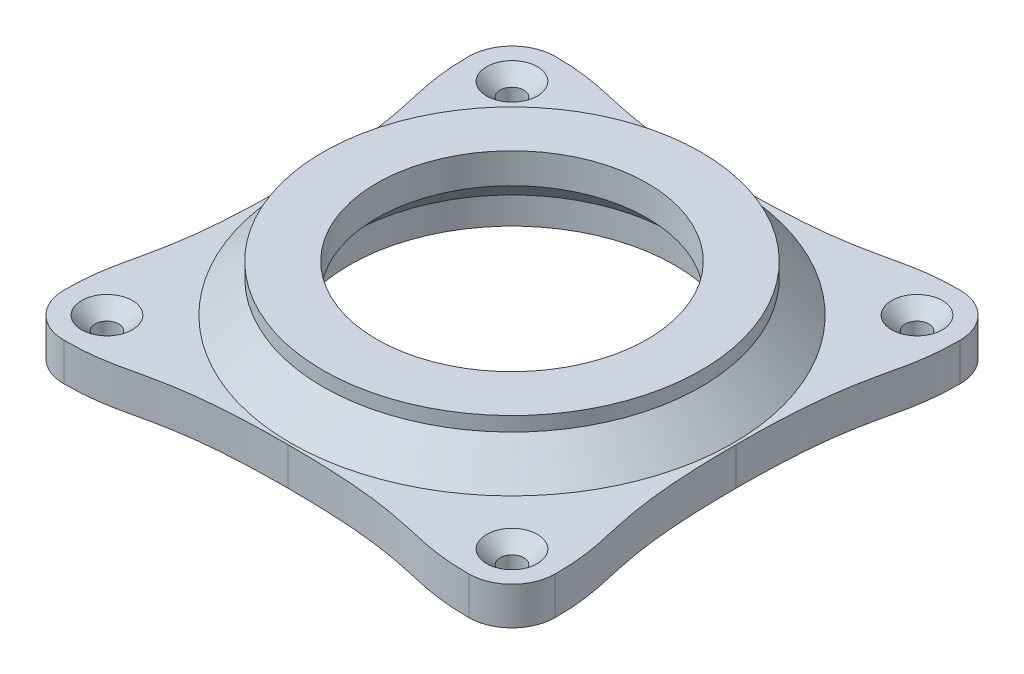
from build123d import *
from build123d.topology import SkipClean

# Parameters (mm, degrees)
SKETCH1_R           = 2.2
SKETCH1_R_2         = 25.05
BOSS_EXTRUDE1_DEPTH = 7
SKETCH6_R           = 35
SKETCH6_R_2         = 25.05
BOSS_EXTRUDE4_DEPTH = 7
CHAMFER1_SIZE       = 2.5
CHAMFER2_SIZE       = 6
BOSS_EXTRUDE8_START = -3.95
SKETCH8_R           = 35
SKETCH8_R_2         = 25.05
BOSS_EXTRUDE8_DEPTH = 5.6


with BuildPart() as part:
    # Sketch1 → Boss-Extrude1 (new body)
    with BuildSketch(Plane(origin=(0, 0, 0), x_dir=(1, 0, 0), z_dir=(0, 1, 0))):
        with BuildLine():
            ThreePointArc((0, 83), (-5.656854249, 80.656854249), (-8, 75))
            add(Edge.make_bspline(
                [(-8, 75), (-8, 62.5), (-4, 62.5), (-4, 37.5)],
                knots=[0, 0, 0, 0, 1, 1, 1, 1], degree=3))
            add(Edge.make_bspline(
                [(-8, 0), (-8, 12.5), (-4, 12.5), (-4, 37.5)],
                knots=[0, 0, 0, 0, 1, 1, 1, 1], degree=3))
            ThreePointArc((-8, 0), (-5.656854249, -5.656854249), (0, -8))
            add(Edge.make_bspline(
                [(0, -8), (12.5, -8), (12.5, -4), (37.5, -4)],
                knots=[0, 0, 0, 0, 1, 1, 1, 1], degree=3))
            add(Edge.make_bspline(
                [(75, -8), (62.5, -8), (62.5, -4), (37.5, -4)],
                knots=[0, 0, 0, 0, 1, 1, 1, 1], degree=3))
            ThreePointArc((75, -8), (80.656854249, -5.656854249), (83, 0))
            add(Edge.make_bspline(
                [(83, 0), (83, 12.5), (79, 12.5), (79, 37.5)],
                knots=[0, 0, 0, 0, 1, 1, 1, 1], degree=3))
            add(Edge.make_bspline(
                [(83, 75), (83, 62.5), (79, 62.5), (79, 37.5)],
                knots=[0, 0, 0, 0, 1, 1, 1, 1], degree=3))
            ThreePointArc((83, 75), (80.656854249, 80.656854249), (75, 83))
            add(Edge.make_bspline(
                [(75, 83), (62.5, 83), (62.5, 79), (37.5, 79)],
                knots=[0, 0, 0, 0, 1, 1, 1, 1], degree=3))
            add(Edge.make_bspline(
                [(0, 83), (12.5, 83), (12.5, 79), (37.5, 79)],
                knots=[0, 0, 0, 0, 1, 1, 1, 1], degree=3))
        make_face()
        with Locations(Location((0, 75, 0), (0, 0, 270))):
            Circle(SKETCH1_R, mode=Mode.SUBTRACT)
        with Locations(Location((75, 75, 0), (0, 0, 270))):
            Circle(SKETCH1_R, mode=Mode.SUBTRACT)
        with Locations(Location((75, 0, 0), (0, 0, 270))):
            Circle(SKETCH1_R, mode=Mode.SUBTRACT)
        with Locations(Location((0, 0, 0), (0, 0, 270))):
            Circle(SKETCH1_R, mode=Mode.SUBTRACT)
        with Locations(Location((37.5, 37.5, 0), (0, 0, 270))):
            Circle(SKETCH1_R_2, mode=Mode.SUBTRACT)
    extrude(amount=BOSS_EXTRUDE1_DEPTH)

    # Sketch6 → Boss-Extrude4 (add)
    with BuildSketch(Plane(origin=(0, 7, 0), x_dir=(1, 0, 0), z_dir=(0, 1, 0))):
        with Locations(Location((37.5, 37.5, 0), (0, 0, 270))):
            Circle(SKETCH6_R)
        with Locations(Location((37.5, 37.5, 0), (0, 0, 270))):
            Circle(SKETCH6_R_2, mode=Mode.SUBTRACT)
    extrude(amount=BOSS_EXTRUDE4_DEPTH)

    # Chamfer1
    chamfer1_edges = [part.edges().sort_by_distance(p)[0] for p in [
        (0, 7, -77.2),
        (75, 7, -77.2),
        (75, 7, -2.2),
        (0, 7, -2.2),
    ]]
    chamfer(chamfer1_edges, length=CHAMFER1_SIZE)

    # Chamfer2
    chamfer2_edges = [part.edges().sort_by_distance(p)[0] for p in [
        (37.5, 7, -72.5),
    ]]
    chamfer(chamfer2_edges, length=CHAMFER2_SIZE)

    # Sketch7 → Cut-Revolve1 (revolve, cut)
    with BuildSketch(Plane.XY.offset(-37.5), mode=Mode.PRIVATE) as cut_revolve1_sk:
        Polygon((67.6, 5), (62.55, 10.05), (62.55, 0), (67.6, 0), align=None)
    revolve(cut_revolve1_sk.sketch.rotate(Axis((37.5, 0, -37.5), (0, 1, 0)), 90), axis=Axis((37.5, 0, -37.5), (0, 1, 0)), mode=Mode.SUBTRACT)

    # Sketch8 → Boss-Extrude8 (add)
    with SkipClean():  # the faces are left unmerged after this step: merging them gives an invalid solid
        with BuildSketch(Plane(origin=(0, 14, 0), x_dir=(1, 0, 0), z_dir=(0, 1, 0)).offset(BOSS_EXTRUDE8_START)):
            with Locations(Location((37.5, 37.5, 0), (0, 0, 270))):
                Circle(SKETCH8_R)
            with Locations(Location((37.5, 37.5, 0), (0, 0, 90))):
                Circle(SKETCH8_R_2, mode=Mode.SUBTRACT)
        extrude(amount=BOSS_EXTRUDE8_DEPTH)


solid = part.part
